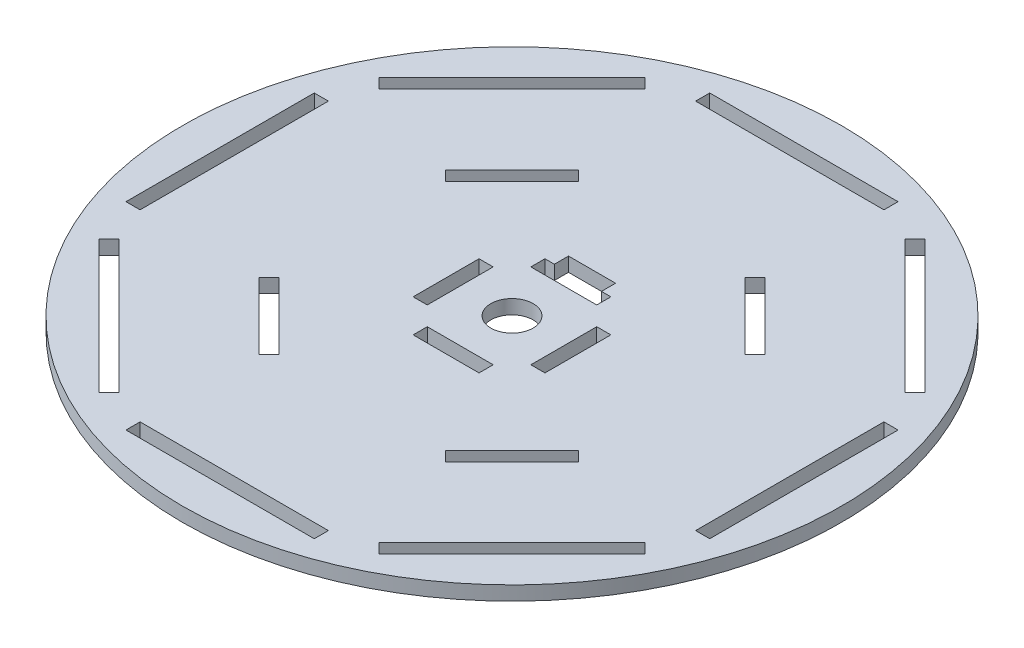
from build123d import *

# Parameters (mm, degrees)
CROQUIS1_R              = 70
CROQUIS1_R_2            = 4.5
SALIENTE_EXTRUIR1_DEPTH = 3


with BuildPart() as part:
    # Croquis1 → Saliente-Extruir1 (new body)
    with BuildSketch(Plane(origin=(0, 0, 0), x_dir=(1, 0, 0), z_dir=(0, 1, 0))):
        with Locations(Location((0, 0, 0), (0, 0, 270))):
            Circle(CROQUIS1_R)
        with Locations(Location((0, 0, 0), (0, 0, 270))):
            Circle(CROQUIS1_R_2, mode=Mode.SUBTRACT)
        Polygon((0, 11), (7, 11), (7, 14), (5, 14), (5, 17), (0, 17), (-5, 17), (-5, 14), (-7, 14), (-7, 11), align=None, mode=Mode.SUBTRACT)
        Polygon((24.748737342, 24.748737342), (31.819805153, 17.67766953), (33.941125497, 19.798989873), (19.798989873, 33.941125497), (17.67766953, 31.819805153), align=None, mode=Mode.SUBTRACT)
        Polygon((11, 0), (11, 7), (14, 7), (14, -7), (11, -7), align=None, mode=Mode.SUBTRACT)
        Polygon((-24.748737342, 24.748737342), (-17.67766953, 31.819805153), (-19.798989873, 33.941125497), (-33.941125497, 19.798989873), (-31.819805153, 17.67766953), align=None, mode=Mode.SUBTRACT)
        Polygon((-14, -7), (-11, -7), (-11, 0), (-11, 7), (-14, 7), align=None, mode=Mode.SUBTRACT)
        Polygon((7, -11), (7, -14), (-7, -14), (-7, -11), (0, -11), align=None, mode=Mode.SUBTRACT)
        Polygon((24.748737342, -24.748737342), (17.67766953, -31.819805153), (19.798989873, -33.941125497), (33.941125497, -19.798989873), (31.819805153, -17.67766953), align=None, mode=Mode.SUBTRACT)
        Polygon((-24.748737342, -24.748737342), (-31.819805153, -17.67766953), (-33.941125497, -19.798989873), (-19.798989873, -33.941125497), (-17.67766953, -31.819805153), align=None, mode=Mode.SUBTRACT)
        Polygon((0, 62), (20, 62), (20, 59), (-20, 59), (-20, 62), align=None, mode=Mode.SUBTRACT)
        Polygon((55.861435714, 27.577164466), (27.577164466, 55.861435714), (29.69848481, 57.982756057), (43.840620434, 43.840620434), (57.982756057, 29.69848481), align=None, mode=Mode.SUBTRACT)
        Polygon((59, -20), (59, 20), (62, 20), (62, 0), (62, -20), align=None, mode=Mode.SUBTRACT)
        Polygon((27.577164466, -55.861435714), (55.861435714, -27.577164466), (57.982756057, -29.69848481), (43.840620434, -43.840620434), (29.69848481, -57.982756057), align=None, mode=Mode.SUBTRACT)
        Polygon((-20, -59), (20, -59), (20, -62), (0, -62), (-20, -62), align=None, mode=Mode.SUBTRACT)
        Polygon((-55.861435714, -27.577164466), (-27.577164466, -55.861435714), (-29.69848481, -57.982756057), (-43.840620434, -43.840620434), (-57.982756057, -29.69848481), align=None, mode=Mode.SUBTRACT)
        Polygon((-59, 20), (-59, -20), (-62, -20), (-62, 0), (-62, 20), align=None, mode=Mode.SUBTRACT)
        Polygon((-27.577164466, 55.861435714), (-55.861435714, 27.577164466), (-57.982756057, 29.69848481), (-43.840620434, 43.840620434), (-29.69848481, 57.982756057), align=None, mode=Mode.SUBTRACT)
    extrude(amount=SALIENTE_EXTRUIR1_DEPTH)


solid = part.part
